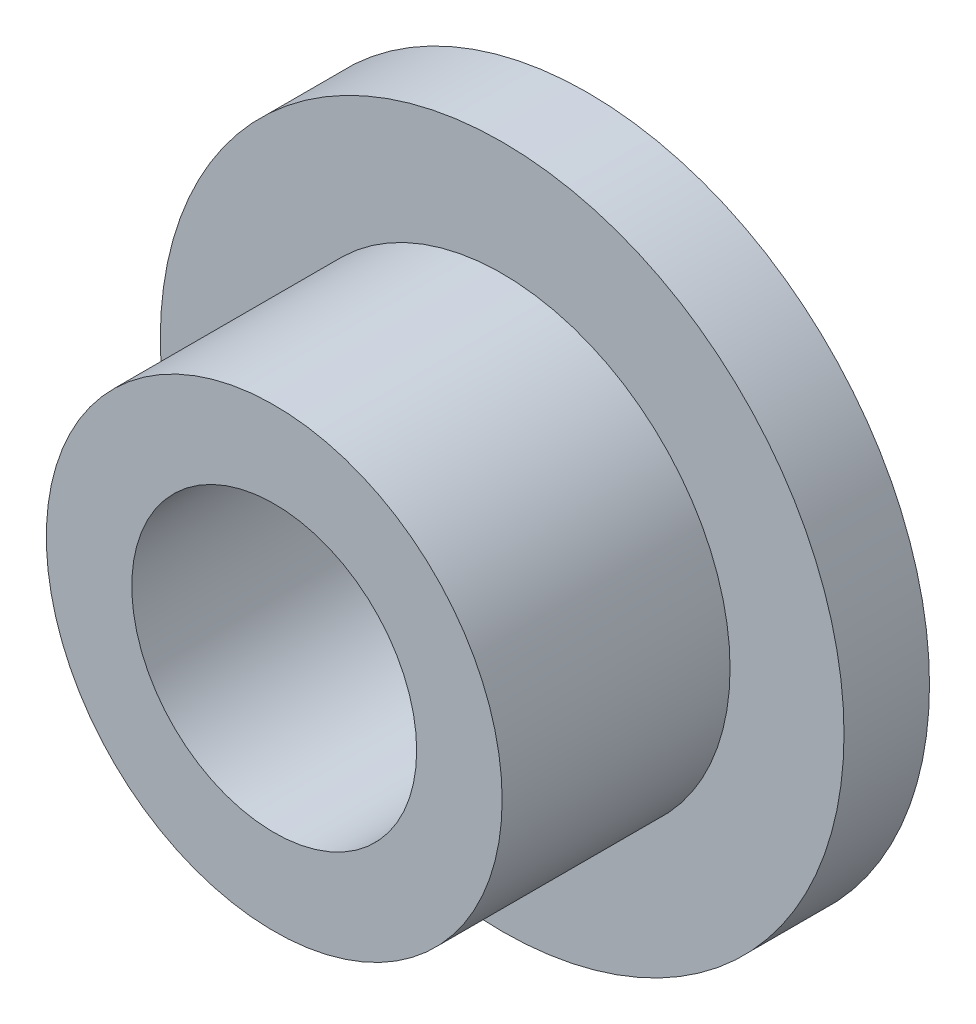
from build123d import *

# Parameters (mm, degrees)
SKETCH1_R           = 6
SKETCH1_R_2         = 4
BOSS_EXTRUDE1_DEPTH = 1.5
SKETCH1_3_R         = 4
SKETCH1_3_R_2       = 2.5
BOSS_EXTRUDE2_DEPTH = 5.5


with BuildPart() as part:
    # Sketch1 → Boss-Extrude1 (new body)
    with BuildSketch(Plane.XY):
        Circle(SKETCH1_R)
        Circle(SKETCH1_R_2, mode=Mode.SUBTRACT)
    extrude(amount=BOSS_EXTRUDE1_DEPTH)

    # Sketch1<3> → Boss-Extrude2 (add)
    with BuildSketch(Plane.XY):
        Circle(SKETCH1_3_R)
        Circle(SKETCH1_3_R_2, mode=Mode.SUBTRACT)
    extrude(amount=BOSS_EXTRUDE2_DEPTH)


solid = part.part
